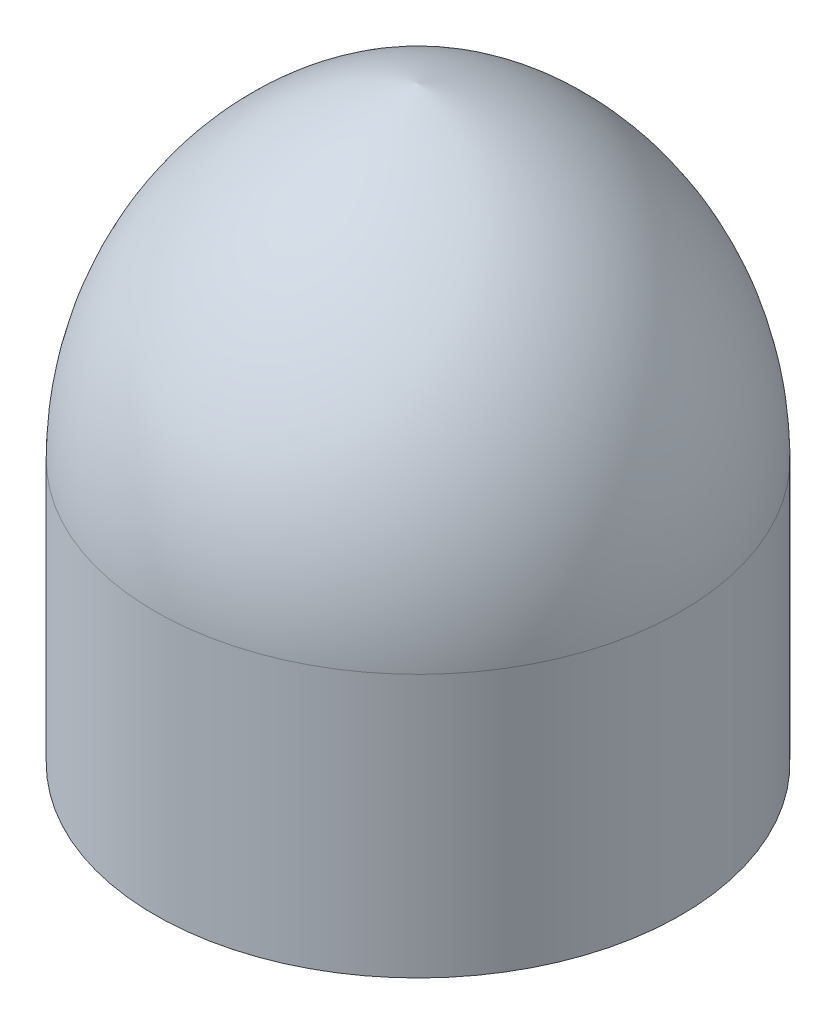
from build123d import *

# Parameters (mm, degrees)
SKETCH2_R          = 3.175
CUT_EXTRUDE1_DEPTH = 12.7


with BuildPart() as part:
    # Sketch1 → Revolve1 (revolve)
    with BuildSketch(Plane.XY, mode=Mode.PRIVATE) as revolve1_sk:
        with BuildLine():
            Line((0, 7.62), (0, 17.055681215))
            ThreePointArc((0, 17.055681215), (5.477126714, 13.684166884), (7.62, 7.62))
            Line((7.62, 7.62), (7.62, 0))
            Line((7.62, 0), (0, 0))
            Line((0, 0), (0, 7.62))
        make_face()
    revolve(revolve1_sk.sketch.rotate(Axis((0, 7.62, 0), (0, 1, 0)), 90), axis=Axis((0, 7.62, 0), (0, 1, 0)))

    # Sketch2 → Cut-Extrude1 (cut)
    with BuildSketch(Plane.XZ):
        with Locations(Location((0, 0, 0), (0, 0, 270))):
            Circle(SKETCH2_R)
    extrude(amount=-CUT_EXTRUDE1_DEPTH, mode=Mode.SUBTRACT)


solid = part.part
